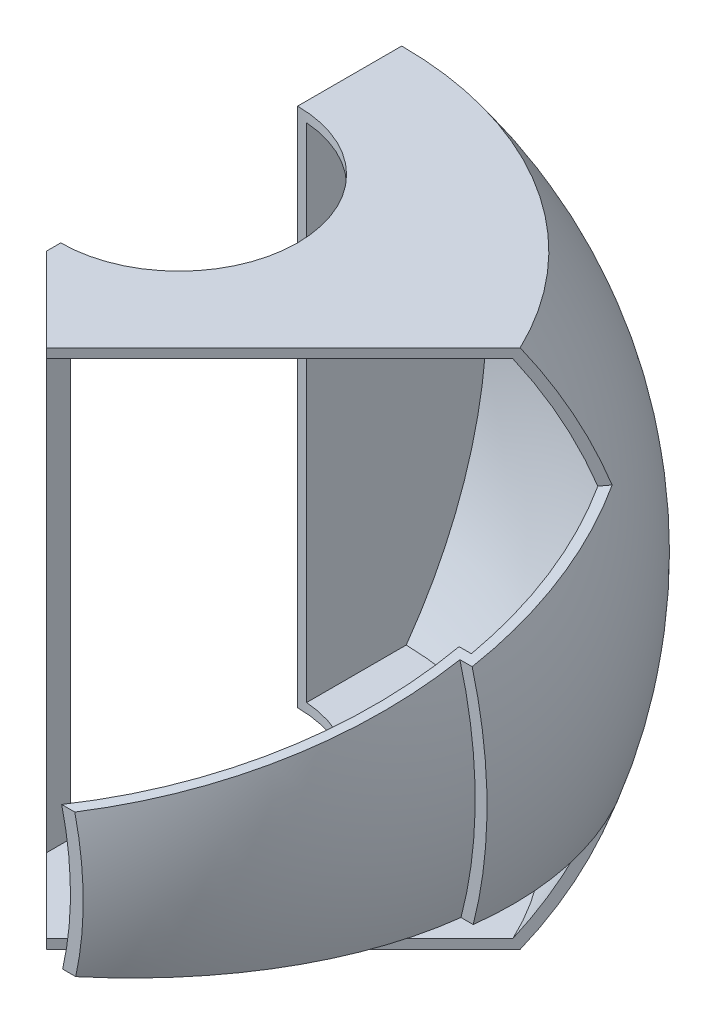
from build123d import *

# Parameters (mm, degrees)
REVOLVE1_ANGLE      = 180
CUT_EXTRUDE2_DEPTH  = 172.464281995
BOSS_EXTRUDE1_DEPTH = 100
CUT_EXTRUDE3_DEPTH  = 172.458449777
CUT_REVOLVE2_ANGLE  = 90
SKETCH8_R           = 25
CUT_EXTRUDE4_DEPTH  = 172.458449777
SHELL1_T            = -2


with BuildPart() as part:
    # Sketch1 → Revolve1 (revolve)
    with BuildSketch(Plane(origin=(0, 0, 0), x_dir=(0, 0, -1), z_dir=(1, 0, 0))):
        with BuildLine():
            Line((0, -55), (0, 55))
            Line((0, 55), (-75, 55))
            ThreePointArc((-75, 55), (-93.005376189, 0), (-75, -55))
            Line((-75, -55), (0, -55))
        make_face()
    revolve(axis=Axis((0, -55, 0), (0, 1, 0)), revolution_arc=REVOLVE1_ANGLE)

    # Sketch2 → Cut-Extrude2 (cut, through all)
    with BuildSketch(Plane.XZ.offset(55)):
        Polygon((0, 0), (17.67766953, 17.67766953), (111.315421254, -75.960082194), (136.865723991, 130.366993467), (-156.179854302, 130.366993467), (-156.179854302, 0), align=None)
    extrude(amount=-CUT_EXTRUDE2_DEPTH, mode=Mode.SUBTRACT)

    # Sketch3 → Boss-Extrude1 (add)
    with BuildSketch(Plane(origin=(100, 0, 0), x_dir=(0, 0, -1), z_dir=(1, 0, 0))):
        Polygon((-60, -14.575168885), (-60, 15.424831115), (45.666627767, 30.424831115), (45.666627767, -29.575168885), align=None)
    extrude(amount=-BOSS_EXTRUDE1_DEPTH)

    # Sketch4 → Cut-Revolve1 (revolve, cut)
    with BuildSketch(Plane(origin=(0, 0, 0), x_dir=(0, 0, -1), z_dir=(1, 0, 0))):
        with BuildLine():
            Line((-74.993333037, 55), (-155.563491861, 55))
            ThreePointArc((-155.563491861, 55), (-165, 0), (-155.563491861, -55))
            Line((-155.563491861, -55), (-74.993333037, -55))
            ThreePointArc((-74.993333037, -55), (-93, 0), (-74.993333037, 55))
        make_face()
    revolve(axis=Axis((0, 0, 0), (0, 1, 0)), mode=Mode.SUBTRACT)

    # Sketch5 → Cut-Extrude3 (cut, through all)
    with BuildSketch(Plane.XZ.offset(55)):
        Polygon((0, 0), (85.80371297, 85.80371297), (-52.713419611, 88.068107595), (-54.153103971, 0), align=None)
    extrude(amount=-CUT_EXTRUDE3_DEPTH, mode=Mode.SUBTRACT)

    # Sketch6 → Cut-Revolve2 (revolve, cut)
    with BuildSketch(Plane(origin=(0, 0, 0), x_dir=(0, 0, -1), z_dir=(1, 0, 0))):
        with BuildLine():
            Line((-71.869673716, 55), (-106.653645039, 55))
            ThreePointArc((-106.653645039, 55), (-120, 0), (-106.653645039, -55))
            Line((-106.653645039, -55), (-71.869673716, -55))
            ThreePointArc((-71.869673716, -55), (-90.5, 0), (-71.869673716, 55))
        make_face()
    revolve(axis=Axis((0, 0, 0), (0, 1, 0)), revolution_arc=CUT_REVOLVE2_ANGLE, mode=Mode.SUBTRACT)

    # Sketch8 → Cut-Extrude4 (cut, through all)
    with BuildSketch(Plane.XZ.offset(55)):
        with Locations((0, -28)):
            Circle(SKETCH8_R)
    extrude(amount=-CUT_EXTRUDE4_DEPTH, mode=Mode.SUBTRACT)

    # Shell1
    shell1_openings = [part.faces().sort_by_distance(p)[0] for p in [
        (63.613809308, 0.358455845, 60),
        (60.693084034, -21.384823609, 12.029783266),
        (60.561459887, 22.228146449, 12.074440738),
        (25, 0, -28),
        (21.502764512, 0.186657, 21.502764512),
        (44.366147497, -39.3465676, -9.010808438),
        (44.26681633, 39.781992256, -8.911477271),
    ]]
    offset(amount=SHELL1_T, openings=shell1_openings, kind=Kind.INTERSECTION)


solid = part.part
